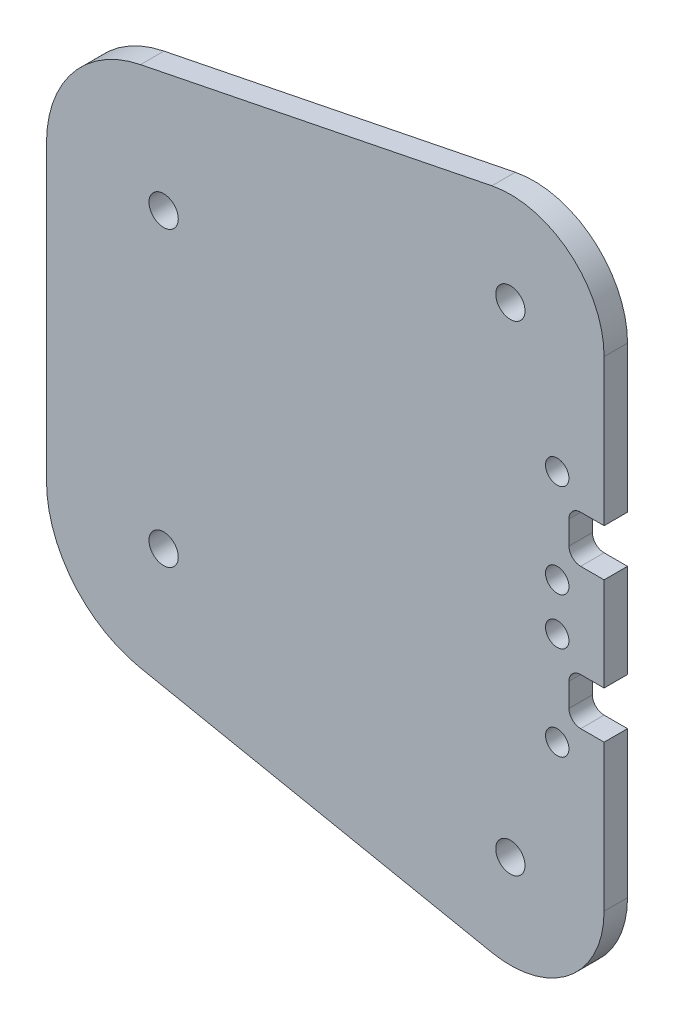
from build123d import *

# Parameters (mm, degrees)
SKETCH_1_R      = 1.25
SKETCH_1_R_2    = 1
EXTRUDE_2_DEPTH = 2


with BuildPart() as part:
    # 草圖1 → 填料-伸長2 (new body)
    with BuildSketch(Plane.XY):
        with BuildLine():
            Line((-28.541905067, -9.1179941), (-28.541905067, -34.1179941))
            ThreePointArc((-28.541905067, -34.1179941), (-26.279428563, -40.452876116), (-20.515759037, -43.921253788))
            Line((-20.515759037, -43.921253788), (9.479011757, -49.960601851))
            ThreePointArc((9.479011757, -49.960601851), (16.126000545, -48.308012897), (19.058094933, -42.1179941))
            Line((19.058094933, -42.1179941), (19.058094933, -29.6179941))
            Line((19.058094933, -29.6179941), (17.058094933, -29.6179941))
            ThreePointArc((17.058094933, -29.6179941), (16.350988152, -29.325100881), (16.058094933, -28.6179941))
            Line((16.058094933, -28.6179941), (16.058094933, -26.6179941))
            ThreePointArc((16.058094933, -26.6179941), (16.350988152, -25.910887319), (17.058094933, -25.6179941))
            Line((17.058094933, -25.6179941), (19.058094933, -25.6179941))
            Line((19.058094933, -25.6179941), (19.058094933, -17.6179941))
            Line((19.058094933, -17.6179941), (17.058094933, -17.6179941))
            ThreePointArc((17.058094933, -17.6179941), (16.350988152, -17.325100881), (16.058094933, -16.6179941))
            Line((16.058094933, -16.6179941), (16.058094933, -14.6179941))
            ThreePointArc((16.058094933, -14.6179941), (16.350988152, -13.910887319), (17.058094933, -13.6179941))
            Line((17.058094933, -13.6179941), (19.058094933, -13.6179941))
            Line((19.058094933, -13.6179941), (19.058094933, -1.1179941))
            ThreePointArc((19.058094933, -1.1179941), (16.126000545, 5.072024696), (9.479011757, 6.72461365))
            Line((9.479011757, 6.72461365), (-20.515759037, 0.685265588))
            ThreePointArc((-20.515759037, 0.685265588), (-26.279428563, -2.783112085), (-28.541905067, -9.1179941))
        make_face()
        with Locations((-18.541905067, -9.1179941)):
            Circle(SKETCH_1_R, mode=Mode.SUBTRACT)
        with Locations((15.058094933, -11.6179941)):
            Circle(SKETCH_1_R_2, mode=Mode.SUBTRACT)
        with Locations((15.058094933, -19.6179941)):
            Circle(SKETCH_1_R_2, mode=Mode.SUBTRACT)
        with Locations((15.058094933, -23.6179941)):
            Circle(SKETCH_1_R_2, mode=Mode.SUBTRACT)
        with Locations((-18.541905067, -34.1179941)):
            Circle(SKETCH_1_R, mode=Mode.SUBTRACT)
        with Locations((11.058094933, -1.1179941)):
            Circle(SKETCH_1_R, mode=Mode.SUBTRACT)
        with Locations((15.058094933, -31.6179941)):
            Circle(SKETCH_1_R_2, mode=Mode.SUBTRACT)
        with Locations((11.058094933, -42.1179941)):
            Circle(SKETCH_1_R, mode=Mode.SUBTRACT)
    extrude(amount=EXTRUDE_2_DEPTH)


solid = part.part
